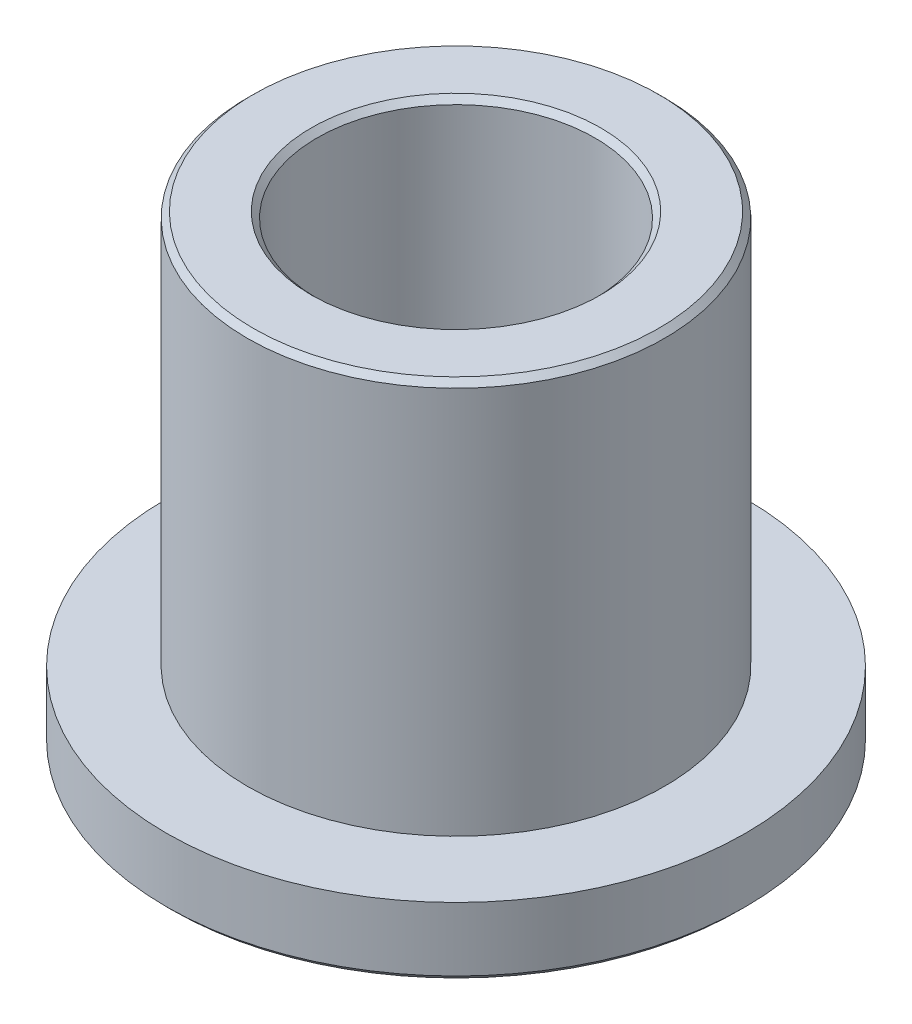
from build123d import *

# Parameters (mm, degrees)
SKETCH_1_R      = 12.5
SKETCH_1_R_2    = 6
EXTRUDE_1_DEPTH = 3
SKETCH_2_R      = 9
SKETCH_2_R_2    = 6
EXTRUDE_2_DEPTH = 17
CHAMFER_1_SIZE  = 0.25


with BuildPart() as part:
    # 草图1 → 凸台-拉伸1 (new body)
    with BuildSketch(Plane(origin=(0, 0, 0), x_dir=(1, 0, 0), z_dir=(0, 1, 0))):
        with Locations(Location((0, 0, 0), (0, 0, 270))):
            Circle(SKETCH_1_R)
        with Locations(Location((0, 0, 0), (0, 0, 270))):
            Circle(SKETCH_1_R_2, mode=Mode.SUBTRACT)
    extrude(amount=EXTRUDE_1_DEPTH)

    # 草图2 → 凸台-拉伸2 (add)
    with BuildSketch(Plane(origin=(0, 3, 0), x_dir=(1, 0, 0), z_dir=(0, 1, 0))):
        with Locations(Location((0, 0, 0), (0, 0, 270))):
            Circle(SKETCH_2_R)
        with Locations(Location((0, 0, 0), (0, 0, 270))):
            Circle(SKETCH_2_R_2, mode=Mode.SUBTRACT)
    extrude(amount=EXTRUDE_2_DEPTH)

    # 倒角1
    chamfer_1_edges = [part.edges().sort_by_distance(p)[0] for p in [
        (0, 20, -9),
        (0, 20, -6),
        (0, 0, -12.5),
        (0, 0, -6),
    ]]
    chamfer(chamfer_1_edges, length=CHAMFER_1_SIZE)


solid = part.part
